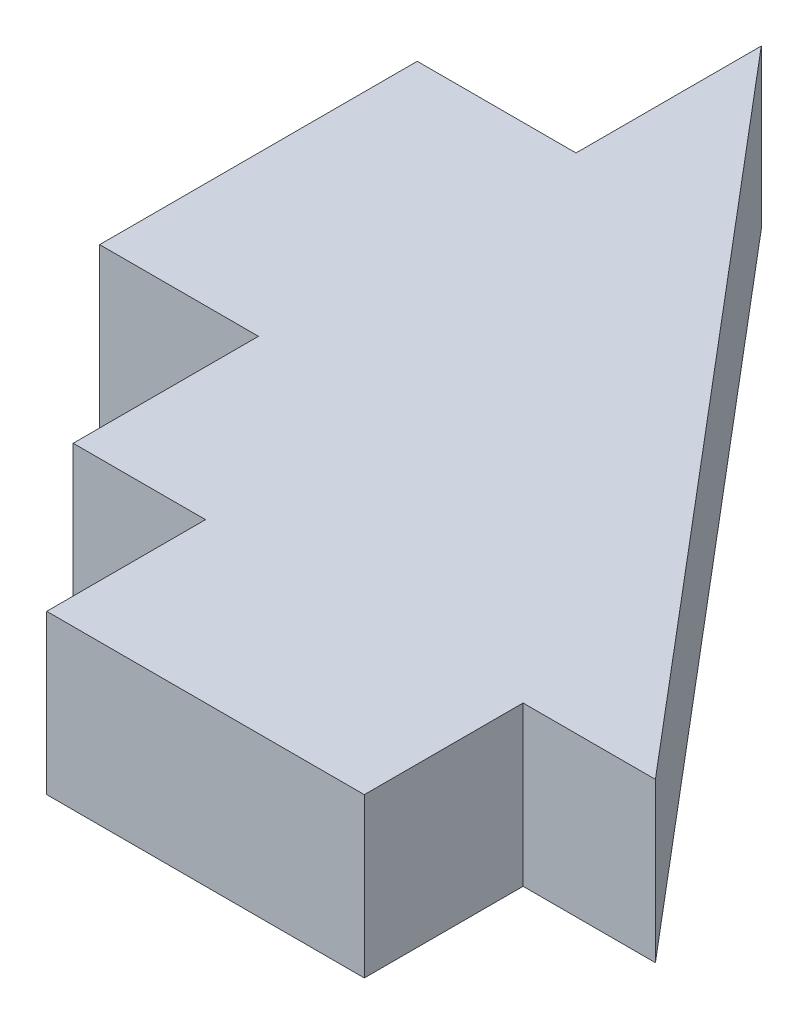
from build123d import *

# Parameters (mm, degrees)
SALIENTE_EXTRUIR1_DEPTH = 3


with BuildPart() as part:
    # Croquis1 → Saliente-Extruir1 (new body)
    with BuildSketch(Plane(origin=(0, 0, 0), x_dir=(1, 0, 0), z_dir=(0, 1, 0))):
        Polygon((0, 0), (2.5, 0), (2.5, -3), (5.5, -3), (8.5, -3), (8.5, 0), (11, 0), (0, 13), (0, 9.5), (-3, 9.5), (-3, 3.5), (0, 3.5), align=None)
    extrude(amount=SALIENTE_EXTRUIR1_DEPTH)


solid = part.part
